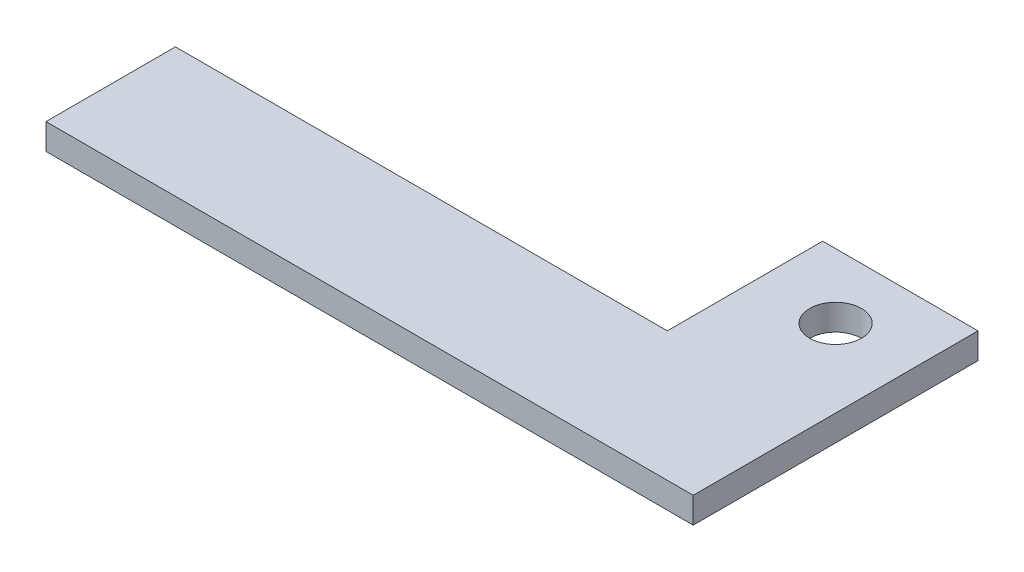
from build123d import *

# Parameters (mm, degrees)
SKETCH1_R           = 2
BOSS_EXTRUDE1_DEPTH = 2


with BuildPart() as part:
    # Sketch1 → Boss-Extrude1 (new body)
    with BuildSketch(Plane(origin=(0, 0, 0), x_dir=(1, 0, 0), z_dir=(0, 1, 0))):
        Polygon((0, 0), (-50, 0), (-50, 10), (-12, 10), (-12, 22), (0, 22), align=None)
        with Locations(Location((-6, 17, 0), (0, 0, 270))):
            Circle(SKETCH1_R, mode=Mode.SUBTRACT)
    extrude(amount=BOSS_EXTRUDE1_DEPTH)


solid = part.part
